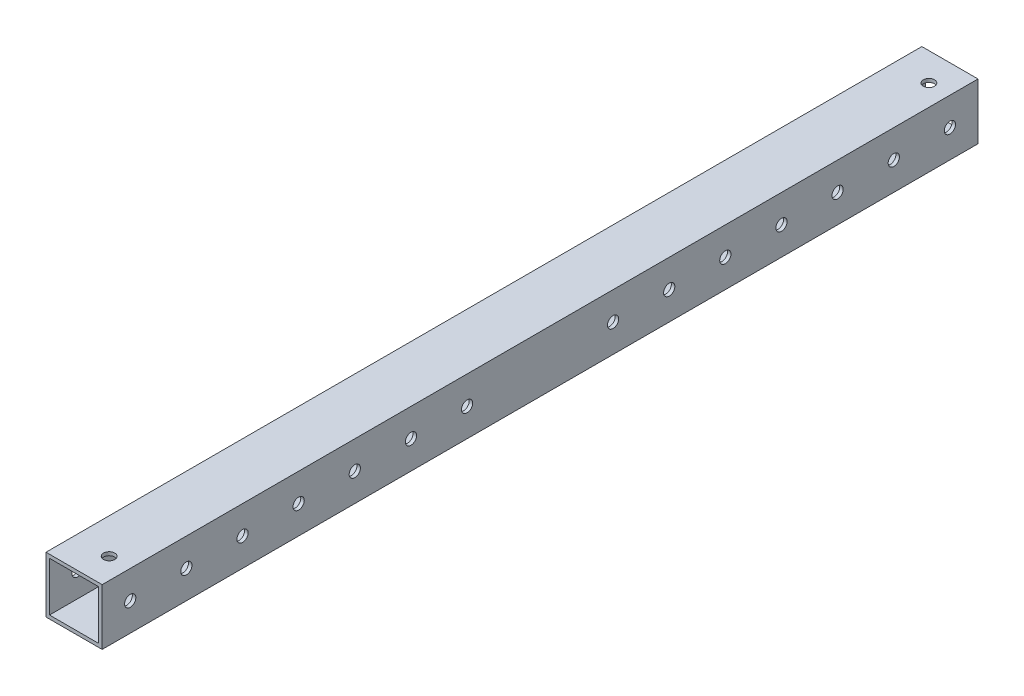
from build123d import *

# Parameters (mm, degrees)
SKETCH1_W           = 25.4
SKETCH1_H           = 25.4
SKETCH1_W_2         = 22.225
SKETCH1_H_2         = 22.225
BOSS_EXTRUDE1_DEPTH = 396.24
SKETCH3_R           = 2.54
CUT_EXTRUDE2_DEPTH  = 398.864873544
SKETCH4_R           = 2.54
CUT_EXTRUDE3_DEPTH  = 398.864873544


with BuildPart() as part:
    # Sketch1 → Boss-Extrude1 (new body)
    with BuildSketch(Plane.XY):
        with Locations((12.7, 12.7)):
            Rectangle(SKETCH1_W, SKETCH1_H)
        with Locations((12.7, 12.7)):
            Rectangle(SKETCH1_W_2, SKETCH1_H_2, mode=Mode.SUBTRACT)
    extrude(amount=BOSS_EXTRUDE1_DEPTH)

    # Sketch3 → Cut-Extrude2 (cut, through all)
    with BuildSketch(Plane(origin=(0, 25.4, 0), x_dir=(1, 0, 0), z_dir=(0, 1, 0))):
        with Locations(Location((15.875, -383.54, 0), (0, 0, 270))):
            Circle(SKETCH3_R)
        with Locations(Location((15.875, -12.7, 0), (0, 0, 270))):
            Circle(SKETCH3_R)
    extrude(amount=-CUT_EXTRUDE2_DEPTH, mode=Mode.SUBTRACT)

    # Sketch4 → Cut-Extrude3 (cut, through all)
    with BuildSketch(Plane(origin=(25.4, 0, 0), x_dir=(0, 0, -1), z_dir=(1, 0, 0))):
        with Locations((-383.54, 12.7)):
            Circle(SKETCH4_R)
        with Locations((-358.14, 12.7)):
            Circle(SKETCH4_R)
        with Locations((-332.74, 12.7)):
            Circle(SKETCH4_R)
        with Locations((-307.34, 12.7)):
            Circle(SKETCH4_R)
        with Locations((-281.94, 12.7)):
            Circle(SKETCH4_R)
        with Locations((-256.54, 12.7)):
            Circle(SKETCH4_R)
        with Locations((-231.14, 12.7)):
            Circle(SKETCH4_R)
        with Locations(Location((-165.1, 12.7, 0), (0, 0, 180))):
            Circle(SKETCH4_R)
        with Locations(Location((-139.7, 12.7, 0), (0, 0, 180))):
            Circle(SKETCH4_R)
        with Locations(Location((-114.3, 12.7, 0), (0, 0, 180))):
            Circle(SKETCH4_R)
        with Locations(Location((-88.9, 12.7, 0), (0, 0, 180))):
            Circle(SKETCH4_R)
        with Locations(Location((-63.5, 12.7, 0), (0, 0, 180))):
            Circle(SKETCH4_R)
        with Locations(Location((-38.1, 12.7, 0), (0, 0, 180))):
            Circle(SKETCH4_R)
        with Locations(Location((-12.7, 12.7, 0), (0, 0, 180))):
            Circle(SKETCH4_R)
    extrude(amount=-CUT_EXTRUDE3_DEPTH, mode=Mode.SUBTRACT)


solid = part.part
